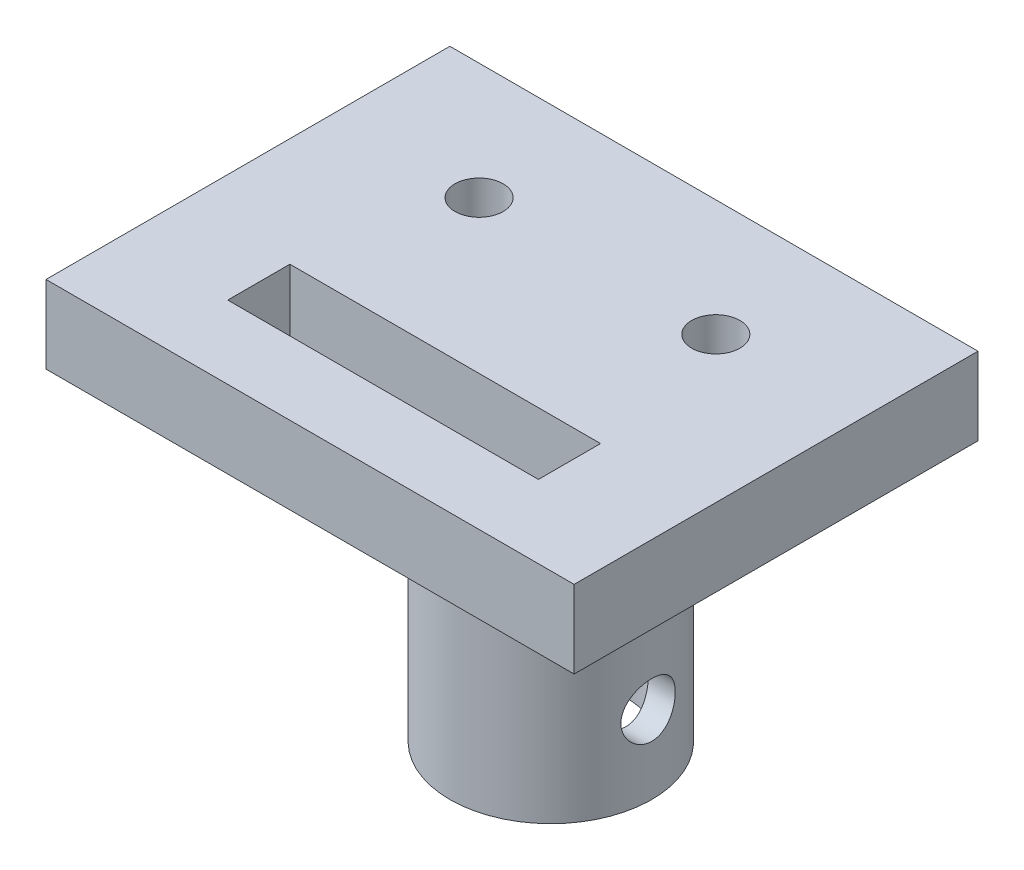
from build123d import *

# Parameters (mm, degrees)
SKETCH1_R               = 6.5
SKETCH1_R_2             = 4.85
BOSS_EXTRUDE1_DEPTH     = 25
SKETCH2_W               = 34
SKETCH2_H               = 26
BOSS_EXTRUDE2_DEPTH     = 5
CUT_EXTRUDE1_DEPTH      = 31.483602149
CUT_EXTRUDE1_DEPTH_BACK = 31.483602149
SKETCH3_R               = 1.55
SKETCH3_W               = 20
SKETCH3_H               = 4
CUT_EXTRUDE2_DEPTH      = 45.958314025
CUT_EXTRUDE2_DEPTH_BACK = 45.958314025
SKETCH4_R               = 1.75


with BuildPart() as part:
    # Sketch1 → Boss-Extrude1 (new body)
    with BuildSketch(Plane(origin=(0, 0, 0), x_dir=(1, 0, 0), z_dir=(0, 1, 0))):
        with Locations(Location((0, 0, 0), (0, 0, 270))):
            Circle(SKETCH1_R)
        with Locations(Location((0, 0, 0), (0, 0, 270))):
            Circle(SKETCH1_R_2, mode=Mode.SUBTRACT)
    extrude(amount=BOSS_EXTRUDE1_DEPTH)

    # Sketch2 → Boss-Extrude2 (add)
    with BuildSketch(Plane(origin=(0, 25, 0), x_dir=(1, 0, 0), z_dir=(0, 1, 0))):
        with Locations((0, -2.5)):
            Rectangle(SKETCH2_W, SKETCH2_H)
    extrude(amount=-BOSS_EXTRUDE2_DEPTH)

    # Sketch3 → Cut-Extrude1 (cut, two sides: drawn at the far end of the back side and taken through both)
    with BuildSketch(Plane(origin=(0, 20, 0), x_dir=(-1, 0, 0), z_dir=(0, -1, 0)).offset(-CUT_EXTRUDE1_DEPTH_BACK)):
        with Locations(Location((-7.62, 3, 0), (0, 0, 270))):
            Circle(SKETCH3_R)
        with Locations(Location((7.62, 3, 0), (0, 0, 270))):
            Circle(SKETCH3_R)
        with Locations((0, -8.8)):
            Rectangle(SKETCH3_W, SKETCH3_H)
    extrude(amount=CUT_EXTRUDE1_DEPTH + CUT_EXTRUDE1_DEPTH_BACK, mode=Mode.SUBTRACT)

    # Sketch4 → Cut-Extrude2 (cut, two sides: drawn at the far end of the back side and taken through both)
    with BuildSketch(Plane(origin=(17, 0, 0), x_dir=(0, 0, -1), z_dir=(1, 0, 0)).offset(-CUT_EXTRUDE2_DEPTH_BACK)):
        with Locations((0, 5)):
            Circle(SKETCH4_R)
    extrude(amount=CUT_EXTRUDE2_DEPTH + CUT_EXTRUDE2_DEPTH_BACK, mode=Mode.SUBTRACT)


solid = part.part
